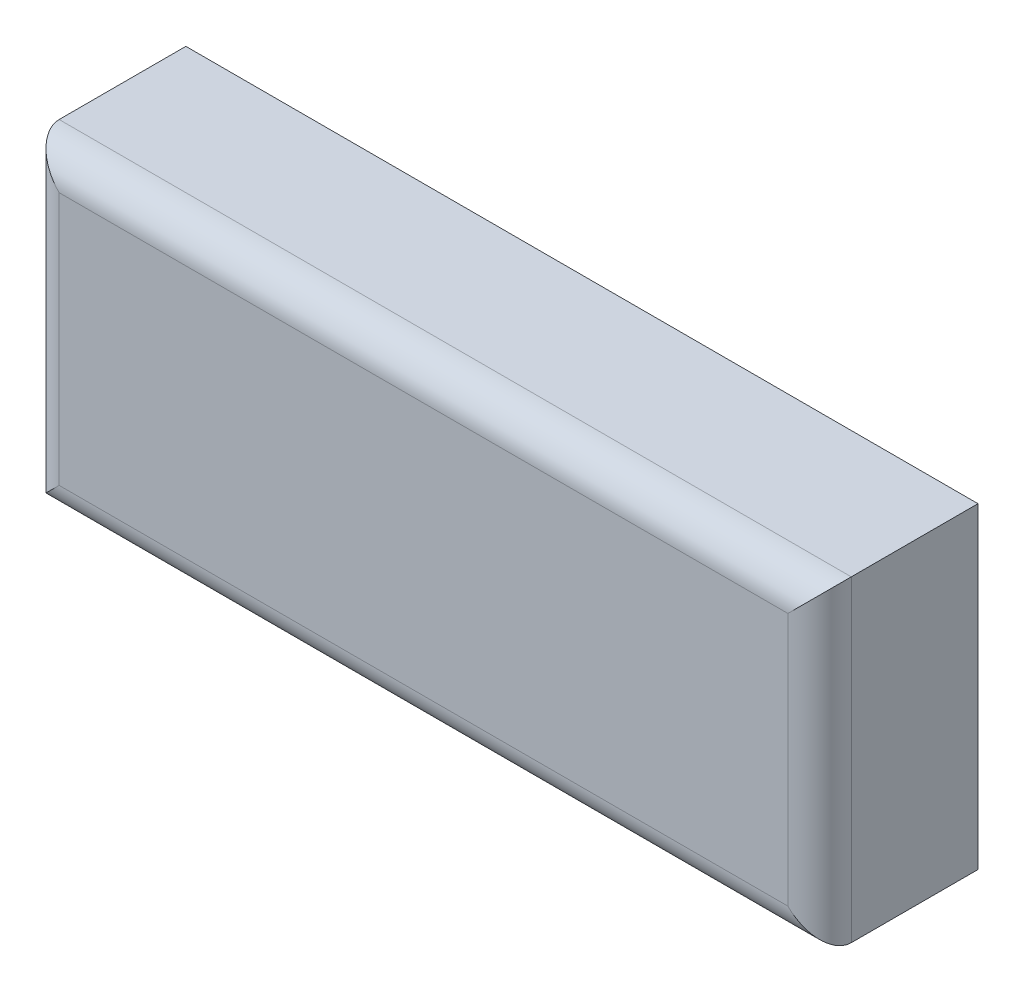
from build123d import *

# Parameters (mm, degrees)
SKETCH_1_W          = 50
SKETCH_1_H          = 20
EXTRUDE_1_DEPTH     = 10
FILLET_1_R          = 2
SKETCH_2_R          = 4
CUT_EXTRUDE_1_DEPTH = 5


with BuildPart() as part:
    # 草图1 → 凸台-拉伸1 (new body)
    with BuildSketch(Plane.XY):
        with Locations((-10.973154362, 5.642841264)):
            Rectangle(SKETCH_1_W, SKETCH_1_H)
    extrude(amount=EXTRUDE_1_DEPTH)

    # 圆角1
    fillet_1_edges = [part.edges().sort_by_distance(p)[0] for p in [
        (14.026845638, 5.642841264, 10),
        (-10.973154362, 15.642841264, 10),
        (-35.973154362, 5.642841264, 10),
        (-10.973154362, -4.357158736, 10),
    ]]
    fillet(fillet_1_edges, radius=FILLET_1_R)

    # 草图2 → 切除-拉伸1 (cut)
    with BuildSketch(Plane(origin=(0, 0, 0), x_dir=(-1, 0, 0), z_dir=(0, 0, -1))):
        with Locations((10.973154362, 5.642841264)):
            Circle(SKETCH_2_R)
    extrude(amount=-CUT_EXTRUDE_1_DEPTH, mode=Mode.SUBTRACT)


solid = part.part
